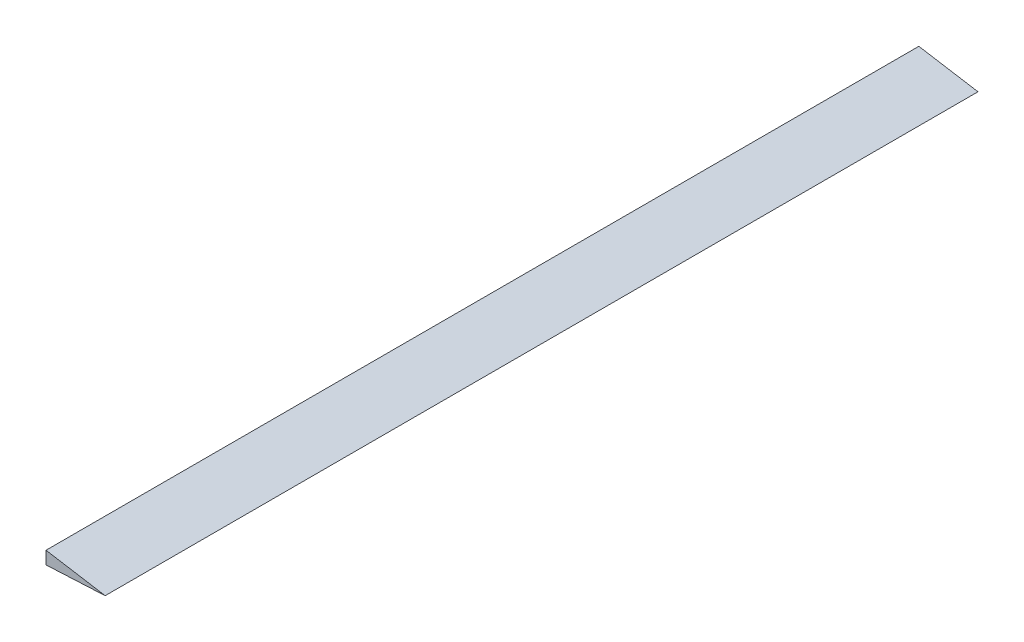
from build123d import *

# Parameters (mm, degrees)
BOSS_EXTRUDE2_DEPTH = 749.299746


with BuildPart() as part:
    # Sketch2 → Boss-Extrude2 (new body)
    with BuildSketch(Plane(origin=(0, 0, -761.999746), x_dir=(-1, 0, 0), z_dir=(0, 0, -1))):
        Polygon((-274.102693551, -2.525772554), (-274.102693551, 8.399511346), (-324.902693551, 0), align=None)
    extrude(amount=-BOSS_EXTRUDE2_DEPTH)


solid = part.part
